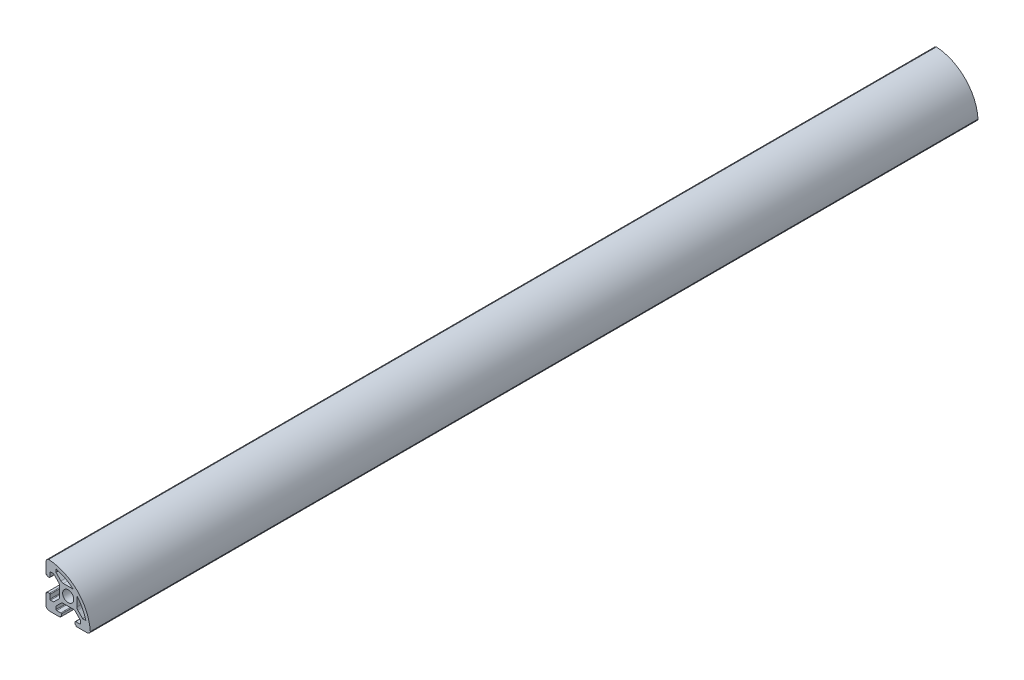
from build123d import *

# Parameters (mm, degrees)
SKETCH_1_R      = 2.5
EXTRUDE_1_DEPTH = 400


with BuildPart() as part:
    # 草图1 → 凸台-拉伸1 (new body)
    with BuildSketch(Plane.XY):
        with BuildLine():
            ThreePointArc((-8.944458369, 9.930115847), (-9.792033903, 9.405190523), (-10.123344197, 8.464890373))
            Line((-10.123344197, 8.464890373), (-10.123344197, 3.564890373))
            Line((-10.123344197, 3.564890373), (-9.823344197, 3.564890373))
            ThreePointArc((-9.823344197, 3.564890373), (-9.681922841, 3.50631173), (-9.623344197, 3.364890373))
            Line((-9.623344197, 3.364890373), (-9.623344197, 3.064890373))
            Line((-9.623344197, 3.064890373), (-8.623344197, 3.064890373))
            ThreePointArc((-8.623344197, 3.064890373), (-8.411212162, 3.152758339), (-8.323344197, 3.364890373))
            Line((-8.323344197, 3.364890373), (-8.323344197, 5.164890373))
            ThreePointArc((-8.323344197, 5.164890373), (-8.235476231, 5.377022408), (-8.023344197, 5.464890373))
            Line((-8.023344197, 5.464890373), (-6.683344197, 5.464890373))
            Line((-6.683344197, 5.464890373), (-4.462684025, 3.244230202))
            ThreePointArc((-4.462684025, 3.244230202), (-4.137524898, 2.757595178), (-4.023344197, 2.18357003))
            Line((-4.023344197, 2.18357003), (-4.023344197, -2.253789283))
            ThreePointArc((-4.023344197, -2.253789283), (-4.137524898, -2.827814432), (-4.462684025, -3.314449455))
            Line((-4.462684025, -3.314449455), (-6.683344197, -5.535109627))
            Line((-6.683344197, -5.535109627), (-8.023344197, -5.535109627))
            ThreePointArc((-8.023344197, -5.535109627), (-8.235476231, -5.447241661), (-8.323344197, -5.235109627))
            Line((-8.323344197, -5.235109627), (-8.323344197, -3.435109627))
            ThreePointArc((-8.323344197, -3.435109627), (-8.411212162, -3.222977592), (-8.623344197, -3.135109627))
            Line((-8.623344197, -3.135109627), (-9.623344197, -3.135109627))
            Line((-9.623344197, -3.135109627), (-9.623344197, -3.435109627))
            ThreePointArc((-9.623344197, -3.435109627), (-9.681922841, -3.576530983), (-9.823344197, -3.635109627))
            Line((-9.823344197, -3.635109627), (-10.123344197, -3.635109627))
            Line((-10.123344197, -3.635109627), (-10.123344197, -8.535109627))
            ThreePointArc((-10.123344197, -8.535109627), (-9.684004369, -9.595769798), (-8.623344197, -10.035109627))
            Line((-8.623344197, -10.035109627), (-3.723344197, -10.035109627))
            Line((-3.723344197, -10.035109627), (-3.723344197, -9.735109627))
            ThreePointArc((-3.723344197, -9.735109627), (-3.664765553, -9.59368827), (-3.523344197, -9.535109627))
            Line((-3.523344197, -9.535109627), (-3.223344197, -9.535109627))
            Line((-3.223344197, -9.535109627), (-3.223344197, -8.535109627))
            ThreePointArc((-3.223344197, -8.535109627), (-3.311212162, -8.322977592), (-3.523344197, -8.235109627))
            Line((-3.523344197, -8.235109627), (-5.323344197, -8.235109627))
            ThreePointArc((-5.323344197, -8.235109627), (-5.535476231, -8.147241661), (-5.623344197, -7.935109627))
            Line((-5.623344197, -7.935109627), (-5.623344197, -6.595109627))
            Line((-5.623344197, -6.595109627), (-3.402684025, -4.374449455))
            ThreePointArc((-3.402684025, -4.374449455), (-2.916049002, -4.049290328), (-2.342023853, -3.935109627))
            Line((-2.342023853, -3.935109627), (2.09533546, -3.935109627))
            ThreePointArc((2.09533546, -3.935109627), (2.669360608, -4.049290328), (3.155995631, -4.374449455))
            Line((3.155995631, -4.374449455), (5.376655803, -6.595109627))
            Line((5.376655803, -6.595109627), (5.376655803, -7.935109627))
            ThreePointArc((5.376655803, -7.935109627), (5.288787838, -8.147241661), (5.076655803, -8.235109627))
            Line((5.076655803, -8.235109627), (3.276655803, -8.235109627))
            ThreePointArc((3.276655803, -8.235109627), (3.064523769, -8.322977592), (2.976655803, -8.535109627))
            Line((2.976655803, -8.535109627), (2.976655803, -9.535109627))
            Line((2.976655803, -9.535109627), (3.276655803, -9.535109627))
            ThreePointArc((3.276655803, -9.535109627), (3.418077159, -9.59368827), (3.476655803, -9.735109627))
            Line((3.476655803, -9.735109627), (3.476655803, -10.035109627))
            Line((3.476655803, -10.035109627), (8.376655803, -10.035109627))
            ThreePointArc((8.376655803, -10.035109627), (9.316955952, -9.703799333), (9.841881277, -8.856223799))
            ThreePointArc((9.841881277, -8.856223799), (4.018791427, 4.107025997), (-8.944458369, 9.930115847))
        make_face()
        with BuildLine():
            ThreePointArc((7.820216628, -5.531930203), (7.798494154, -5.534313715), (7.776655803, -5.535109627))
            Line((7.776655803, -5.535109627), (6.436655803, -5.535109627))
            Line((6.436655803, -5.535109627), (4.215995631, -3.314449455))
            ThreePointArc((4.215995631, -3.314449455), (3.890836504, -2.827814432), (3.776655803, -2.253789283))
            Line((3.776655803, -2.253789283), (3.776655803, 2.173084343))
            ThreePointArc((3.776655803, 2.173084343), (6.257892136, -1.4383023), (7.820216628, -5.531930203))
        make_face(mode=Mode.SUBTRACT)
        with BuildLine():
            ThreePointArc((-5.620164773, 7.908451198), (-1.52653687, 6.346126706), (2.084849773, 3.864890373))
            Line((2.084849773, 3.864890373), (-2.342023853, 3.864890373))
            ThreePointArc((-2.342023853, 3.864890373), (-2.916049002, 3.979071075), (-3.402684025, 4.304230202))
            Line((-3.402684025, 4.304230202), (-5.623344197, 6.524890373))
            Line((-5.623344197, 6.524890373), (-5.623344197, 7.864890373))
            ThreePointArc((-5.623344197, 7.864890373), (-5.622548285, 7.886728724), (-5.620164773, 7.908451198))
        make_face(mode=Mode.SUBTRACT)
        with Locations((-0.123344197, -0.035109627)):
            Circle(SKETCH_1_R, mode=Mode.SUBTRACT)
    extrude(amount=EXTRUDE_1_DEPTH)


solid = part.part
